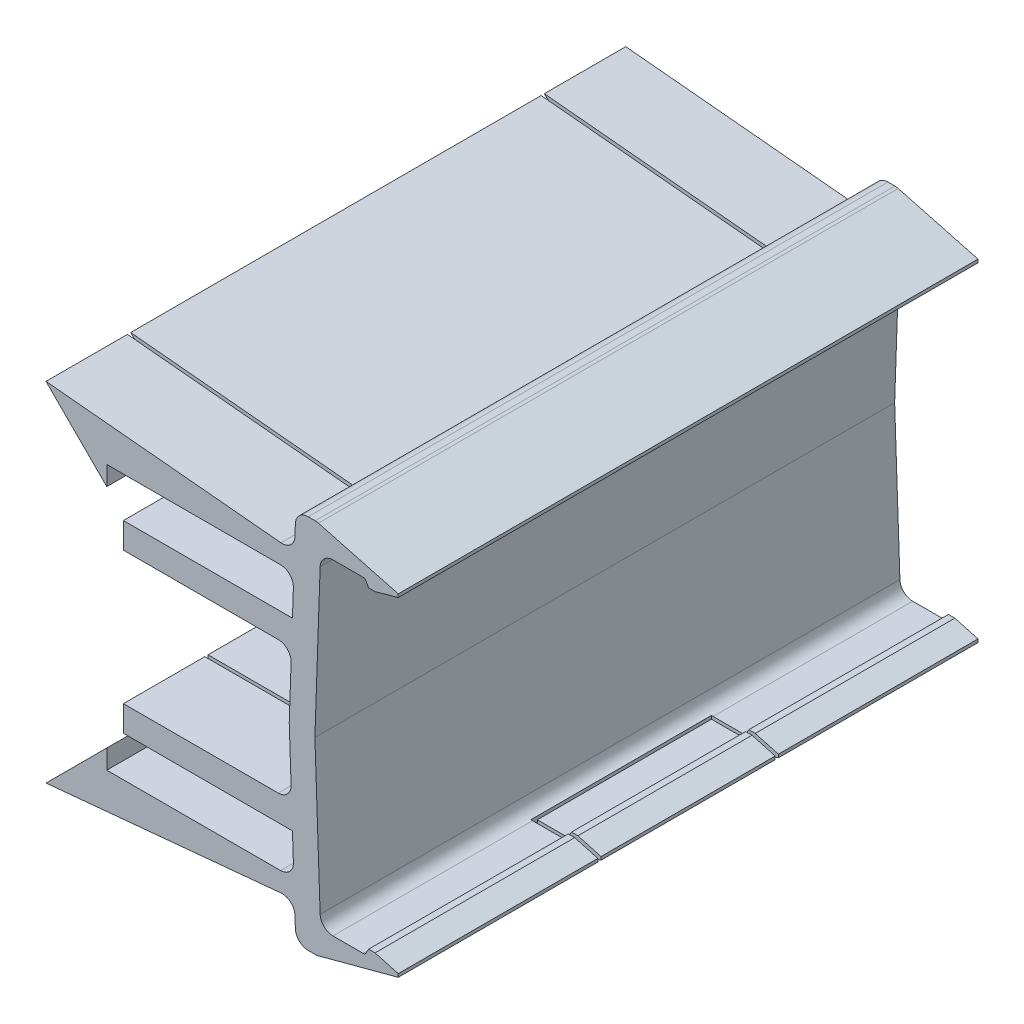
from build123d import *

# Parameters (mm, degrees)
BOSS_EXTRUDE1_DEPTH     = 3.175
BOSS_EXTRUDE2_START     = -3.175
BOSS_EXTRUDE2_DEPTH     = 6.35
BOSS_EXTRUDE3_START     = -3.175
SKETCH3_W               = 13.184505581
SKETCH3_H               = 2
BOSS_EXTRUDE3_DEPTH     = 6.35
FILLET1_R               = 1
CUT_EXTRUDE4_DEPTH      = 32.291096892
CUT_EXTRUDE4_DEPTH_BACK = 32.291096892
SKETCH9_W               = 14.645539482
SKETCH9_H               = 14.645539482
BOSS_EXTRUDE4_DEPTH     = 6.35
BOSS_EXTRUDE5_START     = 32.512
BOSS_EXTRUDE5_DEPTH     = 32.512
SKETCH12_W              = 7.595900531
SKETCH12_H              = 14.08
CUT_EXTRUDE5_DEPTH      = 6.35
BOSS_EXTRUDE6_DEPTH     = 32.011999992
BOSS_EXTRUDE6_2_DEPTH   = 32.011999992
BOSS_EXTRUDE6_3_DEPTH   = 32.011999992
BOSS_EXTRUDE6_4_DEPTH   = 32.011999992
BOSS_EXTRUDE7_DEPTH     = 13.579999992


with BuildPart() as part:
    # Sketch1 → Boss-Extrude1 (new, symmetric)
    with BuildSketch(Plane.XY):
        with BuildLine():
            Line((-6.500091432, 0), (-6.090299711, 11.734899497))
            ThreePointArc((-6.090299711, 11.734899497), (-5.785567255, 12.4193398), (-5.090908884, 12.7))
            Line((-5.090908884, 12.7), (-3.975128678, 12.7))
            Line((-3.975128678, 12.7), (-2.738612788, 12.7))
            ThreePointArc((-2.738612788, 12.7), (-2.613612788, 12.666506351), (-2.522106437, 12.575))
            Line((-2.522106437, 12.575), (-2.305600086, 12.2))
            Line((-2.305600086, 12.2), (-1.805600086, 12.2))
            Line((-1.805600086, 12.2), (0, 12.7))
            Line((0, 12.7), (0, 12.95))
            Line((0, 12.95), (-6.35, 14.645539482))
            Line((-6.35, 14.645539482), (-7.989877012, 14.645539482))
            Line((-7.989877012, 14.645539482), (-8.50131052, 0))
            Line((-8.50131052, 0), (-7.989877012, -14.645539482))
            Line((-7.989877012, -14.645539482), (-6.35, -14.645539482))
            Line((-6.35, -14.645539482), (0, -12.95))
            Line((0, -12.95), (0, -12.7))
            Line((0, -12.7), (-1.805600086, -12.2))
            Line((-1.805600086, -12.2), (-2.305600086, -12.2))
            Line((-2.305600086, -12.2), (-2.522106437, -12.575))
            ThreePointArc((-2.522106437, -12.575), (-2.613612788, -12.666506351), (-2.738612788, -12.7))
            Line((-2.738612788, -12.7), (-3.975128678, -12.7))
            Line((-3.975128678, -12.7), (-5.090908884, -12.7))
            ThreePointArc((-5.090908884, -12.7), (-5.785567255, -12.4193398), (-6.090299711, -11.734899497))
            Line((-6.090299711, -11.734899497), (-6.500091432, 0))
        make_face()
    extrude(amount=BOSS_EXTRUDE1_DEPTH, both=True)

    # Sketch2 → Boss-Extrude2 (add)
    with BuildSketch(Plane.XY.offset(BOSS_EXTRUDE2_START)):
        Polygon((-22.730362754, 10.3251), (-22.730362754, 8.8251), (-27.469260875, 13.563998121), (-8.091860997, 11.725100248), (-8.091860997, 10.3251), align=None)
    extrude(amount=BOSS_EXTRUDE2_DEPTH)

    # Sketch3 → Boss-Extrude3 (add)
    with BuildSketch(Plane.XY.offset(BOSS_EXTRUDE3_START)):
        with Locations((-14.842709964, 6.1835)):
            Rectangle(SKETCH3_W, SKETCH3_H)
    extrude(amount=BOSS_EXTRUDE3_DEPTH)

    # Fillet1
    fillet1_edges = [part.edges().sort_by_distance(p)[0] for p in [
        (-7.989877012, 14.645539482, 0),
        (-6.35, 14.645539482, 0),
        (-8.140750083, 10.3251, 0),
        (-8.091860997, 11.725100248, 0),
        (-8.320298712, 5.1835, 0),
    ]]
    fillet(fillet1_edges, radius=FILLET1_R)

    # Sketch9 → Cut-Extrude4 (cut, two sides: drawn at the far end of the back side and taken through both)
    with BuildSketch(Plane.XY.offset(-CUT_EXTRUDE4_DEPTH_BACK)):
        with Locations((-7.322769741, -7.322769741)):
            Rectangle(SKETCH9_W, SKETCH9_H)
    extrude(amount=CUT_EXTRUDE4_DEPTH + CUT_EXTRUDE4_DEPTH_BACK, mode=Mode.SUBTRACT)

    # Mirror2: part across plane


with BuildPart() as part_1:
    add(part.part)
    add(part.part.mirror(Plane.ZX))



with BuildPart() as body_2:
    # Sketch10 → Boss-Extrude4 (new body)
    with BuildSketch(Plane.XY.offset(42.037)):
        with BuildLine():
            Line((-8.356438198, 4.148600503), (-8.50131052, 0))
            Line((-8.50131052, 0), (-8.356438198, -4.148600503))
            ThreePointArc((-8.356438198, -4.148600503), (-8.636489225, -4.87815837), (-9.355829025, -5.1835))
            Line((-9.355829025, -5.1835), (-21.434962754, -5.1835))
            Line((-21.434962754, -5.1835), (-21.434962754, -7.1835))
            Line((-21.434962754, -7.1835), (-8.250457173, -7.1835))
            Line((-8.250457173, -7.1835), (-8.17688957, -9.290200503))
            ThreePointArc((-8.17688957, -9.290200503), (-8.456940597, -10.01975837), (-9.176280397, -10.3251))
            Line((-9.176280397, -10.3251), (-22.730362754, -10.3251))
            Line((-22.730362754, -10.3251), (-22.730362754, -8.8251))
            Line((-22.730362754, -8.8251), (-27.469260875, -13.563998121))
            Line((-27.469260875, -13.563998121), (-9.148678369, -11.825391269))
            ThreePointArc((-9.148678369, -11.825391269), (-8.394340289, -12.069532985), (-8.054812897, -12.78601904))
            Line((-8.054812897, -12.78601904), (-8.023579064, -13.680438979))
            ThreePointArc((-8.023579064, -13.680438979), (-7.718846608, -14.364879283), (-7.024188237, -14.645539482))
            Line((-7.024188237, -14.645539482), (-6.481208628, -14.645539482))
            ThreePointArc((-6.481208628, -14.645539482), (-6.351115048, -14.637041202), (-6.223232611, -14.611690803))
            Line((-6.223232611, -14.611690803), (0, -12.95))
            Line((0, -12.95), (0, -12.7))
            Line((0, -12.7), (-1.805600086, -12.2))
            Line((-1.805600086, -12.2), (-2.305600086, -12.2))
            Line((-2.305600086, -12.2), (-2.522106437, -12.575))
            ThreePointArc((-2.522106437, -12.575), (-2.613612788, -12.666506351), (-2.738612788, -12.7))
            Line((-2.738612788, -12.7), (-5.090908884, -12.7))
            ThreePointArc((-5.090908884, -12.7), (-5.785567255, -12.4193398), (-6.090299711, -11.734899497))
            Line((-6.090299711, -11.734899497), (-6.500091432, 0))
            Line((-6.500091432, 0), (-6.090299711, 11.734899497))
            ThreePointArc((-6.090299711, 11.734899497), (-5.785567255, 12.4193398), (-5.090908884, 12.7))
            Line((-5.090908884, 12.7), (-2.738612788, 12.7))
            ThreePointArc((-2.738612788, 12.7), (-2.613612788, 12.666506351), (-2.522106437, 12.575))
            Line((-2.522106437, 12.575), (-2.305600086, 12.2))
            Line((-2.305600086, 12.2), (-1.805600086, 12.2))
            Line((-1.805600086, 12.2), (0, 12.7))
            Line((0, 12.7), (0, 12.95))
            Line((0, 12.95), (-6.223232611, 14.611690803))
            ThreePointArc((-6.223232611, 14.611690803), (-6.351115048, 14.637041202), (-6.481208628, 14.645539482))
            Line((-6.481208628, 14.645539482), (-7.024188237, 14.645539482))
            ThreePointArc((-7.024188237, 14.645539482), (-7.718846608, 14.364879283), (-8.023579064, 13.680438979))
            Line((-8.023579064, 13.680438979), (-8.054812897, 12.78601904))
            ThreePointArc((-8.054812897, 12.78601904), (-8.394340289, 12.069532985), (-9.148678369, 11.825391269))
            Line((-9.148678369, 11.825391269), (-27.469260875, 13.563998121))
            Line((-27.469260875, 13.563998121), (-22.730362754, 8.8251))
            Line((-22.730362754, 8.8251), (-22.730362754, 10.3251))
            Line((-22.730362754, 10.3251), (-9.176280397, 10.3251))
            ThreePointArc((-9.176280397, 10.3251), (-8.456940597, 10.01975837), (-8.17688957, 9.290200503))
            Line((-8.17688957, 9.290200503), (-8.250457173, 7.1835))
            Line((-8.250457173, 7.1835), (-21.434962754, 7.1835))
            Line((-21.434962754, 7.1835), (-21.434962754, 5.1835))
            Line((-21.434962754, 5.1835), (-9.355829025, 5.1835))
            ThreePointArc((-9.355829025, 5.1835), (-8.636489225, 4.87815837), (-8.356438198, 4.148600503))
        make_face()
    extrude(amount=-BOSS_EXTRUDE4_DEPTH)


with BuildPart() as part_2:
    add(part_1.part)

    add(body_2.part)  # Boss-Extrude5 merges body 2
    # Sketch11 → Boss-Extrude5 (add)
    with BuildSketch(Plane.XY.offset(3.175).offset(BOSS_EXTRUDE5_START)):
        with BuildLine():
            Line((-6.090299711, 11.734899497), (-6.500091432, 0))
            Line((-6.500091432, 0), (-6.090299711, -11.734899497))
            ThreePointArc((-6.090299711, -11.734899497), (-5.785567255, -12.4193398), (-5.090908884, -12.7))
            Line((-5.090908884, -12.7), (-2.738612788, -12.7))
            ThreePointArc((-2.738612788, -12.7), (-2.613612788, -12.666506351), (-2.522106437, -12.575))
            Line((-2.522106437, -12.575), (-2.305600086, -12.2))
            Line((-2.305600086, -12.2), (-1.805600086, -12.2))
            Line((-1.805600086, -12.2), (0, -12.7))
            Line((0, -12.7), (0, -12.95))
            Line((0, -12.95), (-6.223232611, -14.611690803))
            ThreePointArc((-6.223232611, -14.611690803), (-6.351115048, -14.637041202), (-6.481208628, -14.645539482))
            Line((-6.481208628, -14.645539482), (-7.024188237, -14.645539482))
            ThreePointArc((-7.024188237, -14.645539482), (-7.718846608, -14.364879283), (-8.023579064, -13.680438979))
            Line((-8.023579064, -13.680438979), (-8.50131052, 0))
            Line((-8.50131052, 0), (-8.023579064, 13.680438979))
            ThreePointArc((-8.023579064, 13.680438979), (-7.718846608, 14.364879283), (-7.024188237, 14.645539482))
            Line((-7.024188237, 14.645539482), (-6.481208628, 14.645539482))
            ThreePointArc((-6.481208628, 14.645539482), (-6.351115048, 14.637041202), (-6.223232611, 14.611690803))
            Line((-6.223232611, 14.611690803), (0, 12.95))
            Line((0, 12.95), (0, 12.7))
            Line((0, 12.7), (-1.805600086, 12.2))
            Line((-1.805600086, 12.2), (-2.305600086, 12.2))
            Line((-2.305600086, 12.2), (-2.522106437, 12.575))
            ThreePointArc((-2.522106437, 12.575), (-2.613612788, 12.666506351), (-2.738612788, 12.7))
            Line((-2.738612788, 12.7), (-5.090908884, 12.7))
            ThreePointArc((-5.090908884, 12.7), (-5.785567255, 12.4193398), (-6.090299711, 11.734899497))
        make_face()
    extrude(amount=-BOSS_EXTRUDE5_DEPTH)

    # Sketch12 → Cut-Extrude5 (cut)
    with BuildSketch(Plane.XZ.offset(14.645539482)):
        with Locations((-1.420091432, 19.431)):
            Rectangle(SKETCH12_W, SKETCH12_H)
    extrude(amount=-CUT_EXTRUDE5_DEPTH, mode=Mode.SUBTRACT)


with BuildPart() as body_2_2:
    # Sketch13 → Boss-Extrude6 (new body)
    with BuildSketch(Plane.XY.offset(3.425000008)):
        with BuildLine():
            Line((-8.327744451, -12.133709017), (-8.403653429, -9.959960275))
            ThreePointArc((-8.403653429, -9.959960275), (-8.74899845, -10.229218431), (-9.176280397, -10.3251))
            Line((-9.176280397, -10.3251), (-22.730362754, -10.3251))
            Line((-22.730362754, -10.3251), (-22.730362754, -8.8251))
            Line((-22.730362754, -8.8251), (-27.469260875, -13.563998121))
            Line((-27.469260875, -13.563998121), (-9.148678369, -11.825391269))
            ThreePointArc((-9.148678369, -11.825391269), (-8.702612909, -11.884764757), (-8.327744451, -12.133709017))
        make_face()
    extrude(amount=BOSS_EXTRUDE6_DEPTH)


with BuildPart() as body_3:
    # Sketch13 → Boss-Extrude6 2 (new body)
    with BuildSketch(Plane.XY.offset(3.425000008)):
        with BuildLine():
            Line((-21.434962754, -7.1835), (-8.500609559, -7.1835))
            Line((-8.500609559, -7.1835), (-8.583202058, -4.818360275))
            ThreePointArc((-8.583202058, -4.818360275), (-8.928547078, -5.087618431), (-9.355829025, -5.1835))
            Line((-9.355829025, -5.1835), (-21.434962754, -5.1835))
            Line((-21.434962754, -5.1835), (-21.434962754, -7.1835))
        make_face()
    extrude(amount=BOSS_EXTRUDE6_2_DEPTH)


with BuildPart() as body_4:
    # Sketch13 → Boss-Extrude6 3 (new body)
    with BuildSketch(Plane.XY.offset(3.425000008)):
        with BuildLine():
            Line((-8.583202058, 4.818360275), (-8.500609559, 7.1835))
            Line((-8.500609559, 7.1835), (-21.434962754, 7.1835))
            Line((-21.434962754, 7.1835), (-21.434962754, 5.1835))
            Line((-21.434962754, 5.1835), (-9.355829025, 5.1835))
            ThreePointArc((-9.355829025, 5.1835), (-8.928547078, 5.087618431), (-8.583202058, 4.818360275))
        make_face()
    extrude(amount=BOSS_EXTRUDE6_3_DEPTH)


with BuildPart() as body_5:
    # Sketch13 → Boss-Extrude6 4 (new body)
    with BuildSketch(Plane.XY.offset(3.425000008)):
        with BuildLine():
            Line((-8.403653429, 9.959960275), (-8.327744451, 12.133709017))
            ThreePointArc((-8.327744451, 12.133709017), (-8.702612909, 11.884764757), (-9.148678369, 11.825391269))
            Line((-9.148678369, 11.825391269), (-27.469260875, 13.563998121))
            Line((-27.469260875, 13.563998121), (-22.730362754, 8.8251))
            Line((-22.730362754, 8.8251), (-22.730362754, 10.3251))
            Line((-22.730362754, 10.3251), (-9.176280397, 10.3251))
            ThreePointArc((-9.176280397, 10.3251), (-8.74899845, 10.229218431), (-8.403653429, 9.959960275))
        make_face()
    extrude(amount=BOSS_EXTRUDE6_4_DEPTH)


with BuildPart() as body_6:
    # Sketch14 → Boss-Extrude7 (new body)
    with BuildSketch(Plane.XY.offset(12.641000008)):
        with BuildLine():
            Line((-4.968041697, -12.7), (-4.968041697, -14.276537141))
            Line((-4.968041697, -14.276537141), (0, -12.95))
            Line((0, -12.95), (0, -12.7))
            Line((0, -12.7), (-1.805600086, -12.2))
            Line((-1.805600086, -12.2), (-2.305600086, -12.2))
            Line((-2.305600086, -12.2), (-2.522106437, -12.575))
            ThreePointArc((-2.522106437, -12.575), (-2.613612788, -12.666506351), (-2.738612788, -12.7))
            Line((-2.738612788, -12.7), (-4.968041697, -12.7))
        make_face()
    extrude(amount=BOSS_EXTRUDE7_DEPTH)


solid = Compound([part_2.part, body_2_2.part, body_3.part, body_4.part, body_5.part, body_6.part])
